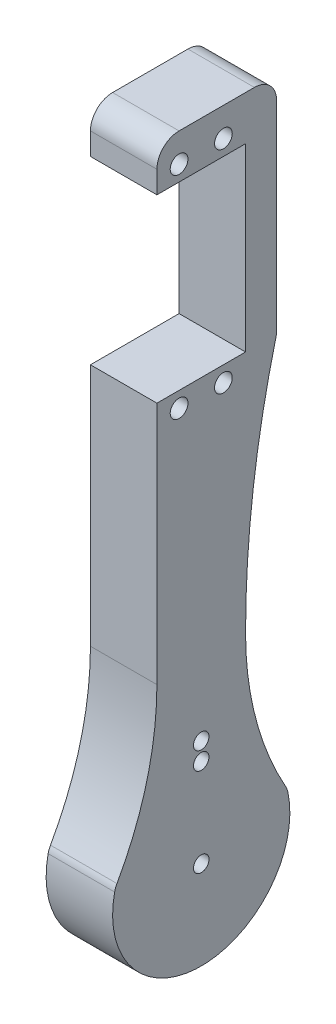
from build123d import *

# Parameters (mm, degrees)
SKETCH1_R           = 2
BOSS_EXTRUDE1_DEPTH = 15
CUT_EXTRUDE1_DEPTH  = 3.86
SKETCH3_R           = 1.75
CUT_EXTRUDE2_DEPTH  = 148.487591342


with BuildPart() as part:
    # Sketch1 → Boss-Extrude1 (new body)
    with BuildSketch(Plane.YZ):
        with BuildLine():
            Line((95, 10), (40, 10))
            ThreePointArc((40, 10), (22.2375432, 12.29110008), (5.637816862, 19.014424902))
            ThreePointArc((5.637816862, 19.014424902), (4.96102116, 19.331638285), (4.24450028, 19.544416527))
            ThreePointArc((4.24450028, 19.544416527), (-20, 0), (4.24450028, -19.544416527))
            ThreePointArc((4.24450028, -19.544416527), (4.96102116, -19.331638285), (5.637816862, -19.014424902))
            ThreePointArc((5.637816862, -19.014424902), (22.2375432, -12.29110008), (40, -10))
            ThreePointArc((40, -10), (67.41148721, -11.71775609), (94.394082105, -16.844147583))
            ThreePointArc((94.394082105, -16.844147583), (95.008519855, -16.960883889), (95.632724183, -17))
            Line((95.632724183, -17), (140.7, -17))
            ThreePointArc((140.7, -17), (144.235533906, -15.535533906), (145.7, -12))
            Line((145.7, -12), (145.7, 5))
            ThreePointArc((145.7, 5), (144.235533906, 8.535533906), (140.7, 10))
            Line((140.7, 10), (135.7, 10))
            Line((135.7, 10), (135.7, -10))
            Line((135.7, -10), (95, -10))
            Line((95, -10), (95, 10))
        make_face()
        with Locations(Location((139.2, -5, 0), (0, 0, 270))):
            Circle(SKETCH1_R, mode=Mode.SUBTRACT)
        with Locations(Location((139.2, 5, 0), (0, 0, 270))):
            Circle(SKETCH1_R, mode=Mode.SUBTRACT)
        with Locations(Location((91.5, -5, 0), (0, 0, 90))):
            Circle(SKETCH1_R, mode=Mode.SUBTRACT)
        with Locations(Location((91.5, 5, 0), (0, 0, 90))):
            Circle(SKETCH1_R, mode=Mode.SUBTRACT)
    extrude(amount=BOSS_EXTRUDE1_DEPTH)

    # Sketch2 → Cut-Extrude1 (cut)
    with BuildSketch(Plane(origin=(0, 0, 0), x_dir=(0, -1, 0), z_dir=(-1, 0, 0))):
        with BuildLine():
            Line((-24.33053856, -3.5), (-12, -3.5))
            ThreePointArc((-12, -3.5), (-8.440790603, -3.996719292), (-5.153570125, -5.448918697))
            ThreePointArc((-5.153570125, -5.448918697), (7.5, 0), (-5.153570125, 5.448918697))
            ThreePointArc((-5.153570125, 5.448918697), (-8.440790603, 3.996719292), (-12, 3.5))
            Line((-12, 3.5), (-24.33053856, 3.5))
            ThreePointArc((-24.33053856, 3.5), (-27.83053856, 0), (-24.33053856, -3.5))
        make_face()
    extrude(amount=-CUT_EXTRUDE1_DEPTH, mode=Mode.SUBTRACT)

    # Sketch3 → Cut-Extrude2 (cut, through all)
    with BuildSketch(Plane(origin=(3.86, 0, 0), x_dir=(0, -1, 0), z_dir=(-1, 0, 0))):
        with Locations(Location((0, 0, 0), (0, 0, 90))):
            Circle(SKETCH3_R)
        with Locations(Location((-20, 0, 0), (0, 0, 90))):
            Circle(SKETCH3_R)
        with Locations(Location((-24, 0, 0), (0, 0, 90))):
            Circle(SKETCH3_R)
    extrude(amount=-CUT_EXTRUDE2_DEPTH, mode=Mode.SUBTRACT)


solid = part.part
